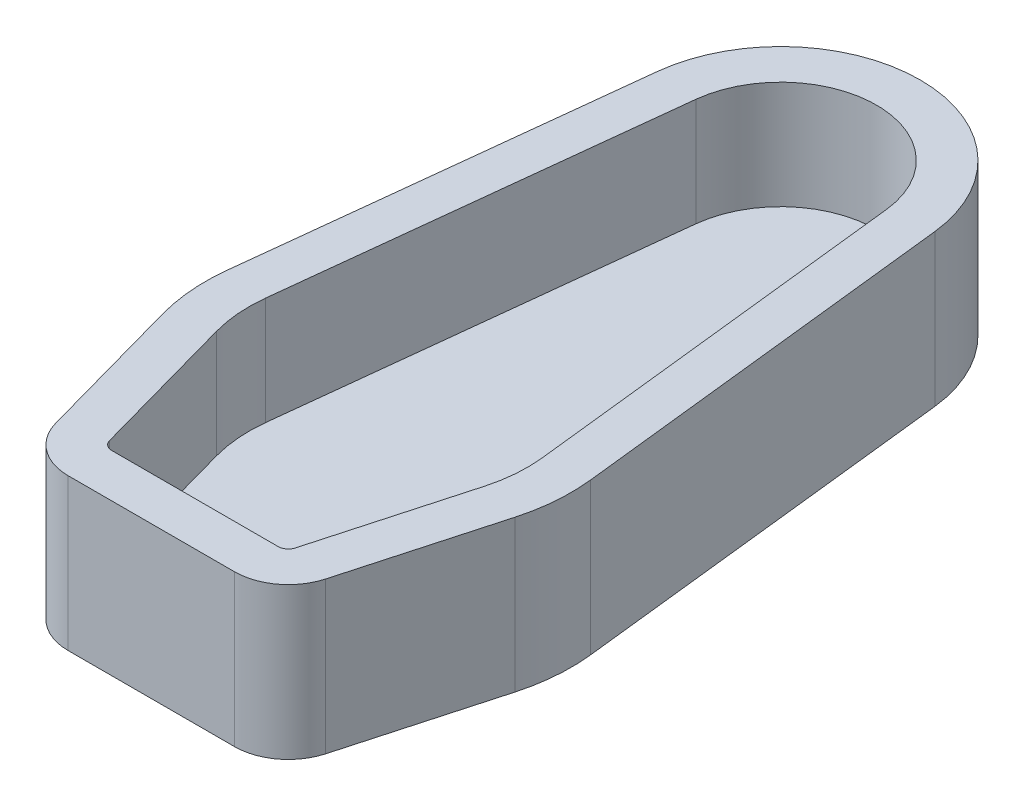
from build123d import *

# Parameters (mm, degrees)
BOSS_EXTRUDE3_DEPTH = 7.5
SHELL1_T            = -2.16


with BuildPart() as part:
    # Sketch1 → Boss-Extrude3 (new body)
    with BuildSketch(Plane(origin=(0, 0, 0), x_dir=(1, 0, 0), z_dir=(0, 1, 0))):
        with BuildLine():
            Line((6.867789963, 15.262601487), (8.997617328, -3.918067904))
            ThreePointArc((8.997617328, -3.918067904), (9.024143463, -5.662644076), (8.71939564, -7.380601705))
            Line((8.71939564, -7.380601705), (6.682914815, -14.711932678))
            ThreePointArc((6.682914815, -14.711932678), (5.729593637, -16.117704054), (4.119957175, -16.66))
            Line((4.119957175, -16.66), (-4.119957175, -16.66))
            ThreePointArc((-4.119957175, -16.66), (-5.729593637, -16.117704054), (-6.682914815, -14.711932678))
            Line((-6.682914815, -14.711932678), (-8.71939564, -7.380601705))
            ThreePointArc((-8.71939564, -7.380601705), (-9.024143463, -5.662644076), (-8.997617328, -3.918067904))
            Line((-8.997617328, -3.918067904), (-6.867789963, 15.262601487))
            ThreePointArc((-6.867789963, 15.262601487), (0, 21.41), (6.867789963, 15.262601487))
        make_face()
    extrude(amount=BOSS_EXTRUDE3_DEPTH)

    # Shell1
    shell1_openings = [part.faces().sort_by_distance(p)[0] for p in [
        (0, 7.5, -1.411749104),
    ]]
    offset(amount=SHELL1_T, openings=shell1_openings, kind=Kind.INTERSECTION)


solid = part.part
